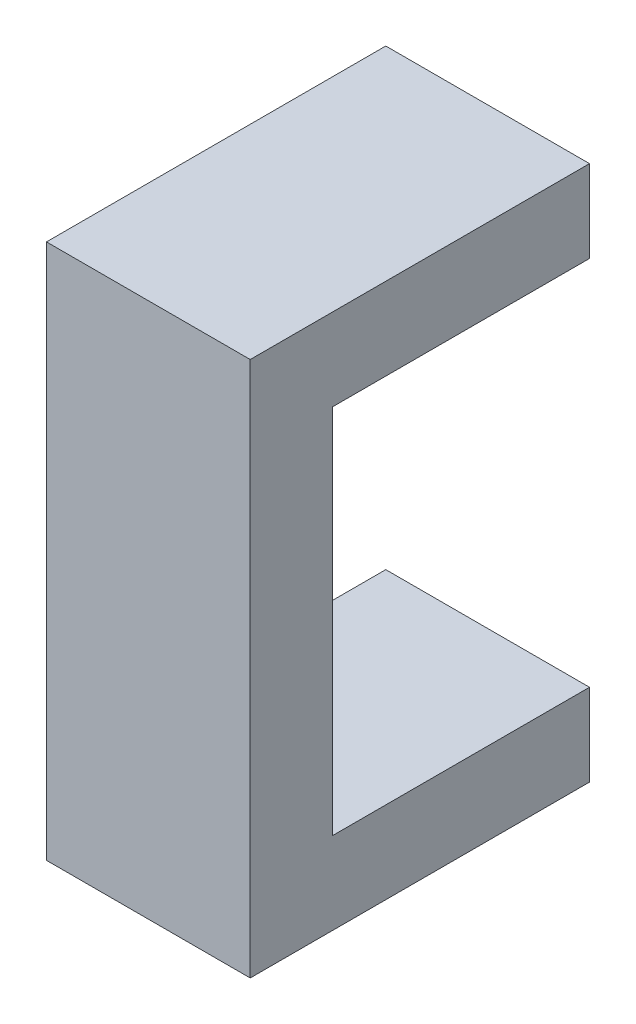
from build123d import *

# Parameters (mm, degrees)
SKETCH1_W           = 15.65
SKETCH1_H           = 5
SKETCH1_W_2         = 5
SKETCH1_H_2         = 32.6
BOSS_EXTRUDE1_DEPTH = 12.4


with BuildPart() as part:
    # Sketch1 → Boss-Extrude1 (new body)
    with BuildSketch(Plane(origin=(0, 0, 0), x_dir=(0, 0, -1), z_dir=(1, 0, 0))):
        with Locations((10.325, 13.8)):
            Rectangle(SKETCH1_W, SKETCH1_H)
        Rectangle(SKETCH1_W_2, SKETCH1_H_2)
        with Locations((10.325, -13.8)):
            Rectangle(SKETCH1_W, SKETCH1_H)
    extrude(amount=BOSS_EXTRUDE1_DEPTH)


solid = part.part
